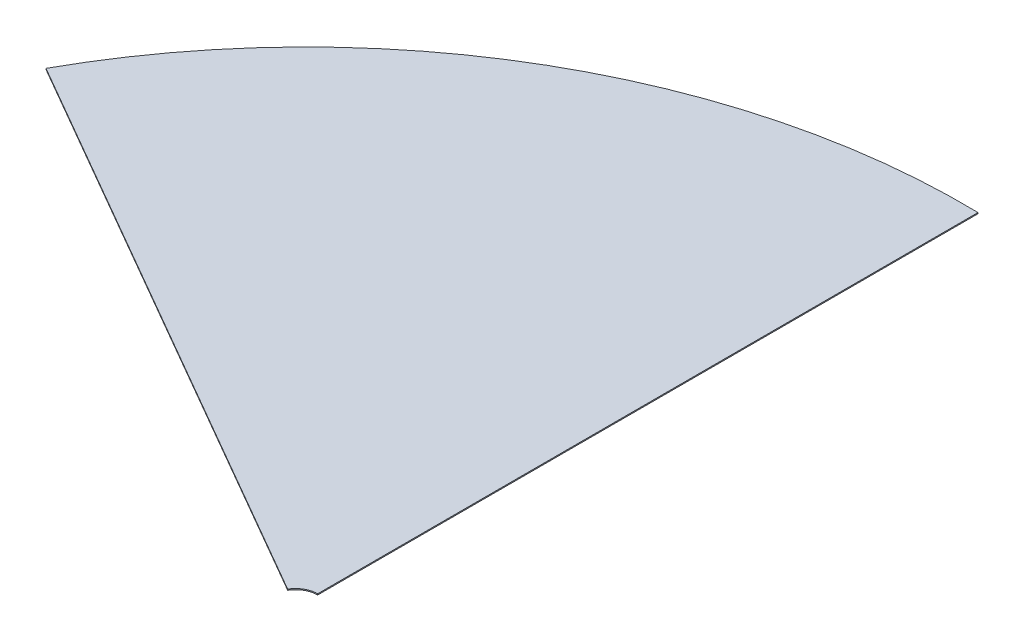
from build123d import *

# Parameters (mm, degrees)
BOSS_EXTRUDE1_DEPTH = 0.5


with BuildPart() as part:
    # Sketch1 → Boss-Extrude1 (new body)
    with BuildSketch(Plane(origin=(0, 0, 0), x_dir=(1, 0, 0), z_dir=(0, 1, 0))):
        with BuildLine():
            Line((0, 10), (0, 310.47))
            ThreePointArc((0, 310.47), (-156.122680126, 270.412414192), (-268.874907113, 155.235))
            Line((-268.874907113, 155.235), (-8.660254038, 5))
            ThreePointArc((-8.660254038, 5), (-5, 8.660254038), (0, 10))
        make_face()
    extrude(amount=BOSS_EXTRUDE1_DEPTH)


solid = part.part
